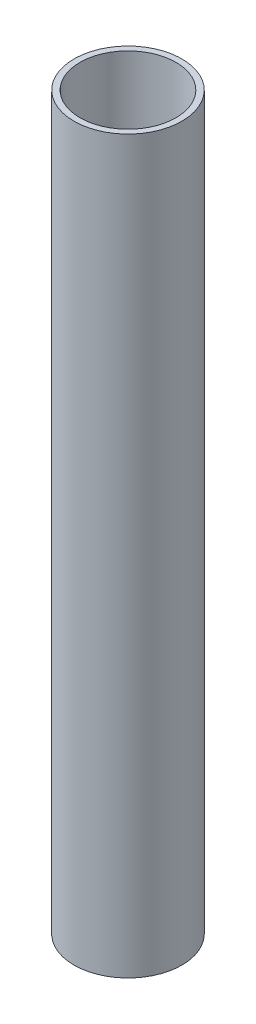
from build123d import *

# Parameters (mm, degrees)
SKETCH1_R           = 15
SKETCH1_R_2         = 13.349
BOSS_EXTRUDE1_DEPTH = 203.2


with BuildPart() as part:
    # Sketch1 → Boss-Extrude1 (new body)
    with BuildSketch(Plane(origin=(0, 0, 0), x_dir=(1, 0, 0), z_dir=(0, 1, 0))):
        with Locations(Location((0, 0, 0), (0, 0, 270))):
            Circle(SKETCH1_R)
        with Locations(Location((0, 0, 0), (0, 0, 270))):
            Circle(SKETCH1_R_2, mode=Mode.SUBTRACT)
    extrude(amount=BOSS_EXTRUDE1_DEPTH)


solid = part.part
